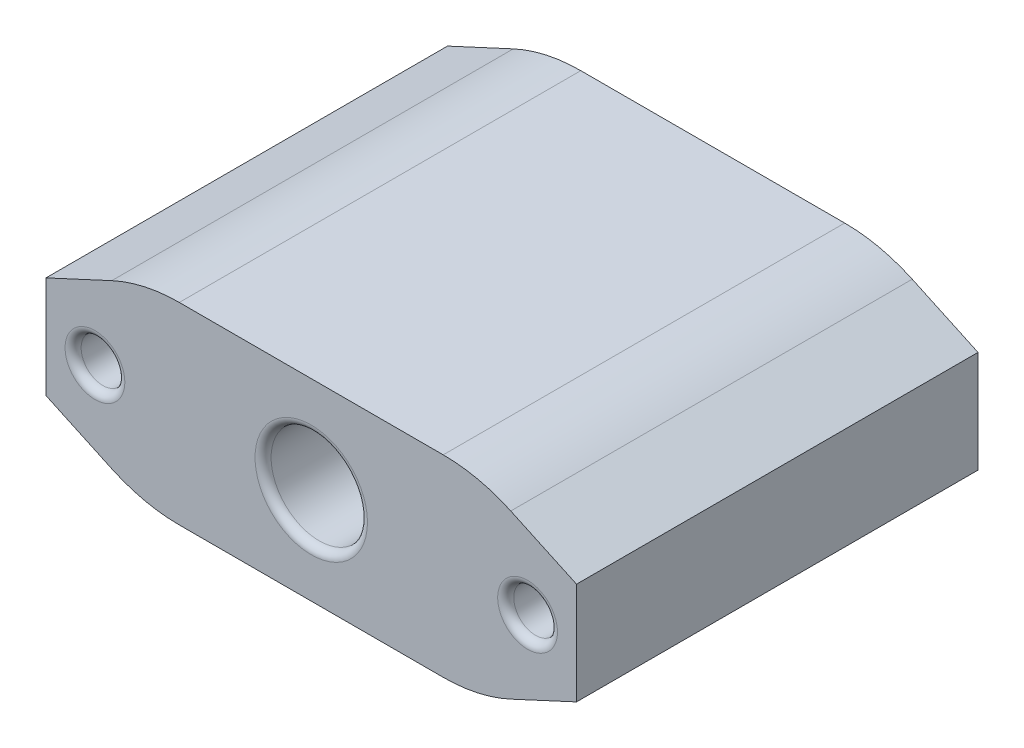
from build123d import *

# Parameters (mm, degrees)
SKETCH1_R           = 1.360934182
SKETCH1_R_2         = 3
BOSS_EXTRUDE1_DEPTH = 25
FILLET1_R           = 10
FILLET2_R           = 10
FILLET4_R           = 10
FILLET5_R           = 10
FILLET8_R           = 0.5
FILLET9_R           = 0.5
FILLET10_R          = 0.5
FILLET11_R          = 0.5
FILLET12_R          = 0.5
FILLET13_R          = 0.5


with BuildPart() as part:
    # Sketch1 → Boss-Extrude1 (new body)
    with BuildSketch(Plane(origin=(0, 0, 0), x_dir=(-1, 0, 0), z_dir=(0, 0, 1))):
        Polygon((16.51797461, 3.175), (16.51797461, -3.175), (10.42197461, -6), (-10.42197461, -6), (-16.51797461, -3.175), (-16.51797461, 3.175), (-10.42197461, 6), (10.42197461, 6), align=None)
        with Locations(Location((13.46997461, 0, 0), (0, 0, 180))):
            Circle(SKETCH1_R, mode=Mode.SUBTRACT)
        with Locations((-13.46997461, 0)):
            Circle(SKETCH1_R, mode=Mode.SUBTRACT)
        with Locations(Location((0, 0, 0), (0, 0, 180))):
            Circle(SKETCH1_R_2, mode=Mode.SUBTRACT)
    extrude(amount=BOSS_EXTRUDE1_DEPTH)

    # Fillet1
    fillet1_edges = [part.edges().sort_by_distance(p)[0] for p in [
        (-10.42197461, 6, 12.5),
    ]]
    fillet(fillet1_edges, radius=FILLET1_R)

    # Fillet2
    fillet2_edges = [part.edges().sort_by_distance(p)[0] for p in [
        (-10.42197461, -6, 12.5),
    ]]
    fillet(fillet2_edges, radius=FILLET2_R)

    # Fillet4
    fillet4_edges = [part.edges().sort_by_distance(p)[0] for p in [
        (10.42197461, -6, 12.5),
    ]]
    fillet(fillet4_edges, radius=FILLET4_R)

    # Fillet5
    fillet5_edges = [part.edges().sort_by_distance(p)[0] for p in [
        (10.42197461, 6, 12.5),
    ]]
    fillet(fillet5_edges, radius=FILLET5_R)

    # Fillet8
    fillet8_edges = [part.edges().sort_by_distance(p)[0] for p in [
        (-3, 0, 0),
    ]]
    fillet(fillet8_edges, radius=FILLET8_R)

    # Fillet9
    fillet9_edges = [part.edges().sort_by_distance(p)[0] for p in [
        (14.830908792, 0, 0),
    ]]
    fillet(fillet9_edges, radius=FILLET9_R)

    # Fillet10
    fillet10_edges = [part.edges().sort_by_distance(p)[0] for p in [
        (-14.830908792, 0, 0),
    ]]
    fillet(fillet10_edges, radius=FILLET10_R)

    # Fillet11
    fillet11_edges = [part.edges().sort_by_distance(p)[0] for p in [
        (-3, 0, 25),
    ]]
    fillet(fillet11_edges, radius=FILLET11_R)

    # Fillet12
    fillet12_edges = [part.edges().sort_by_distance(p)[0] for p in [
        (14.830908792, 0, 25),
    ]]
    fillet(fillet12_edges, radius=FILLET12_R)

    # Fillet13
    fillet13_edges = [part.edges().sort_by_distance(p)[0] for p in [
        (-14.830908792, 0, 25),
    ]]
    fillet(fillet13_edges, radius=FILLET13_R)


solid = part.part
